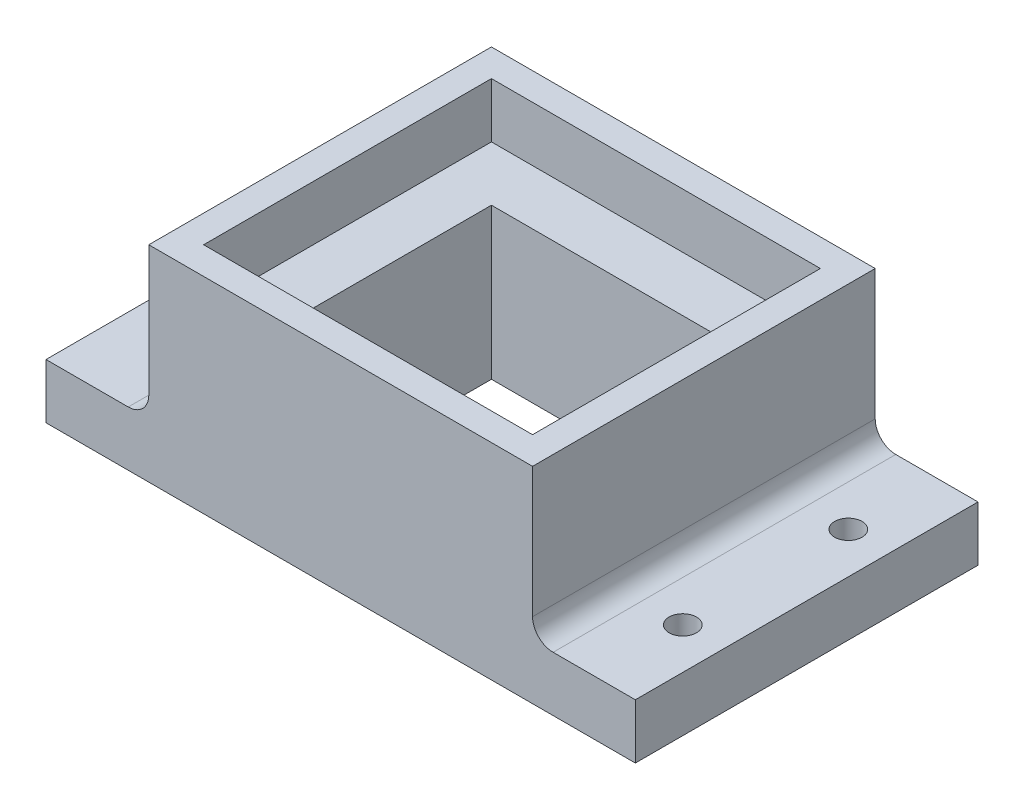
from build123d import *

# Parameters (mm, degrees)
SKETCH1_W               = 56
SKETCH1_H               = 50
BOSS_EXTRUDE1_DEPTH     = 30
SKETCH3_W               = 48
SKETCH3_H               = 42
CUT_EXTRUDE1_DEPTH      = 8
SKETCH4_W               = 15
SKETCH4_H               = 8
BOSS_EXTRUDE2_DEPTH     = 50
FILLET1_R               = 3
CUT_EXTRUDE2_DEPTH      = 55.387498564
CUT_EXTRUDE2_DEPTH_BACK = 55.387498564
SKETCH5_W               = 32
SKETCH5_H               = 26
CUT_EXTRUDE3_DEPTH      = 55.387498564
CUT_EXTRUDE3_DEPTH_BACK = 55.387498564
SKETCH6_R               = 2


with BuildPart() as part:
    # Sketch1 → Boss-Extrude1 (new body)
    with BuildSketch(Plane(origin=(0, 0, 0), x_dir=(1, 0, 0), z_dir=(0, 1, 0))):
        Rectangle(SKETCH1_W, SKETCH1_H)
    extrude(amount=BOSS_EXTRUDE1_DEPTH)

    # Sketch3 → Cut-Extrude1 (cut)
    with BuildSketch(Plane(origin=(0, 30, 0), x_dir=(1, 0, 0), z_dir=(0, 1, 0))):
        Rectangle(SKETCH3_W, SKETCH3_H)
    extrude(amount=-CUT_EXTRUDE1_DEPTH, mode=Mode.SUBTRACT)

    # Sketch4 → Boss-Extrude2 (add)
    with BuildSketch(Plane.XY.offset(25)):
        with Locations((-35.5, 4)):
            Rectangle(SKETCH4_W, SKETCH4_H)
        with Locations((35.5, 4)):
            Rectangle(SKETCH4_W, SKETCH4_H)
    extrude(amount=-BOSS_EXTRUDE2_DEPTH)

    # Fillet1
    fillet1_edges = [part.edges().sort_by_distance(p)[0] for p in [
        (-28, 8, 0),
        (28, 8, 0),
    ]]
    fillet(fillet1_edges, radius=FILLET1_R)

    # Sketch5 → Cut-Extrude2 (cut, two sides: drawn at the far end of the back side and taken through both)
    with BuildSketch(Plane(origin=(0, 22, 0), x_dir=(1, 0, 0), z_dir=(0, 1, 0)).offset(-CUT_EXTRUDE2_DEPTH_BACK)):
        Rectangle(SKETCH5_W, SKETCH5_H)
    extrude(amount=CUT_EXTRUDE2_DEPTH + CUT_EXTRUDE2_DEPTH_BACK, mode=Mode.SUBTRACT)

    # Sketch6 → Cut-Extrude3 (cut, two sides: drawn at the far end of the back side and taken through both)
    with BuildSketch(Plane(origin=(0, 8, 0), x_dir=(1, 0, 0), z_dir=(0, 1, 0)).offset(-CUT_EXTRUDE3_DEPTH_BACK)):
        with Locations(Location((-37, 12.079385962, 0), (0, 0, 180))):
            Circle(SKETCH6_R)
        with Locations(Location((-37, -12.079385962, 0), (0, 0, 180))):
            Circle(SKETCH6_R)
        with Locations((37, -12.079385962)):
            Circle(SKETCH6_R)
        with Locations((37, 12.079385962)):
            Circle(SKETCH6_R)
    extrude(amount=CUT_EXTRUDE3_DEPTH + CUT_EXTRUDE3_DEPTH_BACK, mode=Mode.SUBTRACT)


solid = part.part
